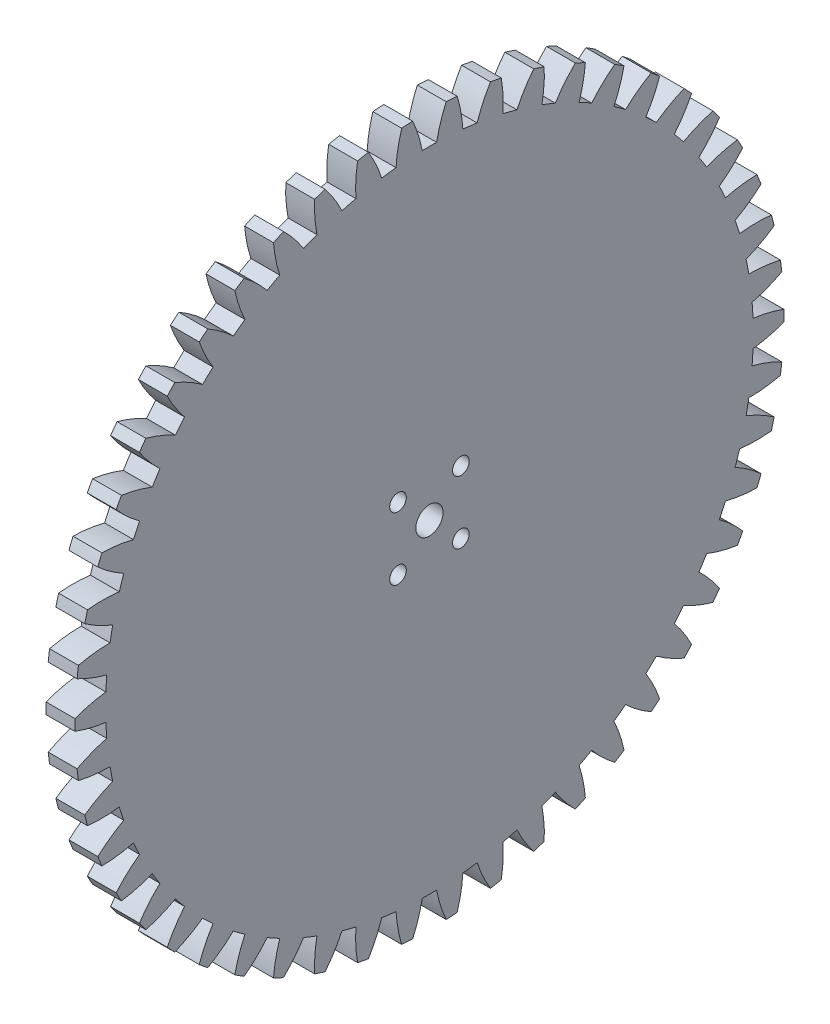
from build123d import *

# Parameters (mm, degrees)
BASPROSKE_W                  = 6.35
BASPROSKE_H                  = 78
TOOTHCUT_DEPTH               = 111.491277936
TEETHCUTS_COUNT              = 50
TEETHCUTS_ANGLE              = 352.8
BORSKE_R                     = 3
BORE_DEPTH                   = 50.0000508
ENL_V_MAT_EXTRU_1_REACH      = 112.43
ESQUISSE1_R                  = 1.83
R_P_TITION_CIRCULAIRE1_COUNT = 4


with BuildPart() as part:
    # BasProSke → Base-Revolve (revolve)
    with BuildSketch(Plane(origin=(0, 0, 0), x_dir=(1, 0, 0), z_dir=(0, 1, 0)), mode=Mode.PRIVATE) as base_revolve_sk:
        with Locations((3.175, 39)):
            Rectangle(BASPROSKE_W, BASPROSKE_H)
    revolve(base_revolve_sk.sketch.rotate(Axis((-10, 0, 0), (1, 0, 0)), 180), axis=Axis((-10, 0, 0), (1, 0, 0)))

    # TooCutSke → ToothCut (cut, through all)
    with BuildSketch(Plane(origin=(0, 0, 0), x_dir=(0, 0, -1), z_dir=(1, 0, 0))):
        with BuildLine():
            ThreePointArc((1.584443832, 71.231380295), (0, 71.249), (-1.584443832, 71.231380295))
            ThreePointArc((-1.584443832, 71.231380295), (-2.443481522, 74.646676615), (-3.696827947, 77.937773309))
            ThreePointArc((-3.696827947, 77.937773309), (0, 78.0254), (3.696827947, 77.937773309))
            ThreePointArc((3.696827947, 77.937773309), (2.443481522, 74.646676615), (1.584443832, 71.231380295))
        make_face()
    toothcut = extrude(amount=TOOTHCUT_DEPTH, mode=Mode.SUBTRACT)

    # TeethCuts: ToothCut ×50 about axis
    teethcuts_axis = Axis((-10, 0, 0), (1, 0, 0))
    for i in range(1, TEETHCUTS_COUNT):
        add(toothcut.rotate(teethcuts_axis, i * TEETHCUTS_ANGLE / (TEETHCUTS_COUNT - 1)), mode=Mode.SUBTRACT)

    # BorSke → Bore (cut, symmetric)
    with BuildSketch(Plane(origin=(0, 0, 0), x_dir=(0, 0, -1), z_dir=(1, 0, 0))):
        with Locations(Location((0, 0, 0), (0, 0, 180))):
            Circle(BORSKE_R)
    extrude(amount=BORE_DEPTH, both=True, mode=Mode.SUBTRACT)

    # Esquisse1 → Enlèv. mat.-Extru.1 (cut, up to next)
    with BuildSketch(Plane.ZY, mode=Mode.PRIVATE) as enl_v_mat_extru_1_sk1:
        with Locations((6.914797213, 6.914797213)):
            Circle(ESQUISSE1_R)
    enl_v_mat_extru_1_tool1 = extrude(enl_v_mat_extru_1_sk1.sketch, amount=-ENL_V_MAT_EXTRU_1_REACH, mode=Mode.PRIVATE) & part.part
    enl_v_mat_extru_1 = enl_v_mat_extru_1_tool1.solids().sort_by_distance((0, 6.914797, 6.914797))[0]
    add(enl_v_mat_extru_1, mode=Mode.SUBTRACT)

    # Répétition circulaire1: Enlèv. mat.-Extru.1 ×4 about axis
    r_p_tition_circulaire1_axis = Axis((0, 0, 0), (1, 0, 0))
    for i in range(1, R_P_TITION_CIRCULAIRE1_COUNT):
        add(enl_v_mat_extru_1.rotate(r_p_tition_circulaire1_axis, i * 360 / R_P_TITION_CIRCULAIRE1_COUNT), mode=Mode.SUBTRACT)


solid = part.part
